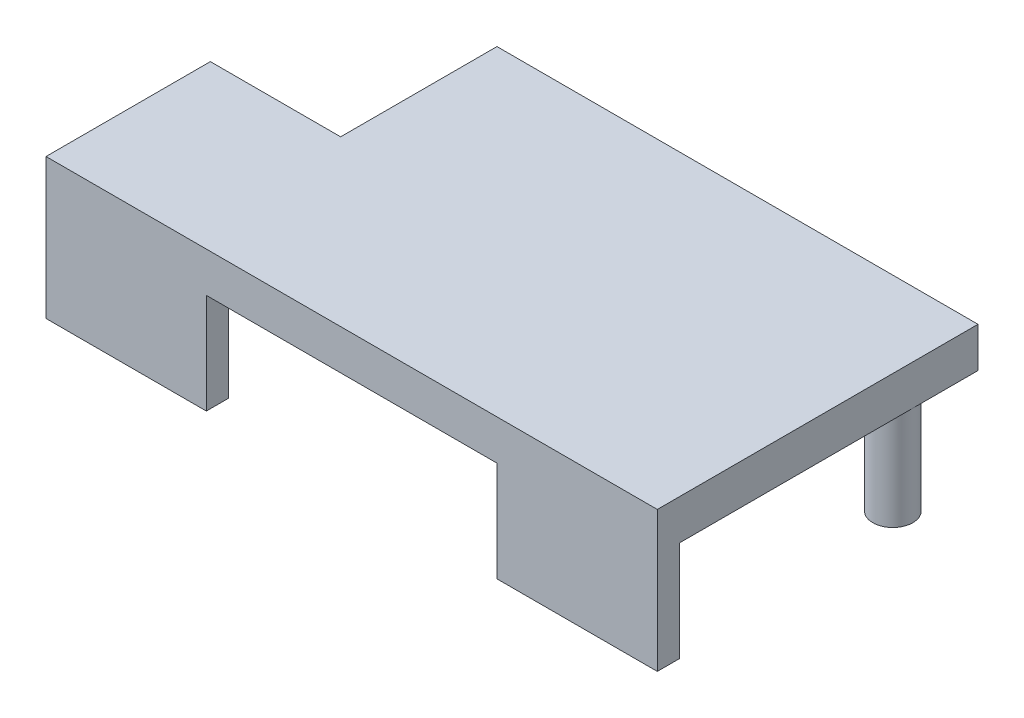
from build123d import *

# Parameters (mm, degrees)
SKETCH1_W           = 30.5
SKETCH1_H           = 16
BOSS_EXTRUDE1_DEPTH = 2
SKETCH3_R           = 1
SKETCH3_W           = 2.9
SKETCH3_H           = 2.8
SKETCH3_W_2         = 8
SKETCH3_H_2         = 1.1
BOSS_EXTRUDE3_DEPTH = 8
CUT_EXTRUDE2_DEPTH  = 10
CUT_EXTRUDE3_START  = -3
SKETCH5_R           = 1
SKETCH5_W           = 30.5
SKETCH5_H           = 1.1
CUT_EXTRUDE3_DEPTH  = 3


with BuildPart() as part:
    # Sketch1 → Boss-Extrude1 (new body)
    with BuildSketch(Plane(origin=(0, 0, 0), x_dir=(1, 0, 0), z_dir=(0, 1, 0))):
        Rectangle(SKETCH1_W, SKETCH1_H)
    extrude(amount=BOSS_EXTRUDE1_DEPTH)

    # Sketch3 → Boss-Extrude3 (add)
    with BuildSketch(Plane(origin=(0, 0, 0), x_dir=(1, 0, 0), z_dir=(0, 1, 0))):
        with Locations(Location((14.2, 4.8, 0), (0, 0, 270))):
            Circle(SKETCH3_R)
        with Locations((-4.25, 6.6)):
            Rectangle(SKETCH3_W, SKETCH3_H)
        with Locations((-11.25, -7.45)):
            Rectangle(SKETCH3_W_2, SKETCH3_H_2)
        with Locations((11.25, -7.45)):
            Rectangle(SKETCH3_W_2, SKETCH3_H_2)
    extrude(amount=-BOSS_EXTRUDE3_DEPTH)

    # Sketch4 → Cut-Extrude2 (cut)
    with BuildSketch(Plane(origin=(0, 0, 0), x_dir=(1, 0, 0), z_dir=(0, 1, 0))):
        Polygon((-15.25, 2.7), (-15.25, 8), (-8.75, 8), (-8.75, 2.7), (-8.75, 0.2), (-15.25, 0.2), align=None)
    extrude(amount=CUT_EXTRUDE2_DEPTH, mode=Mode.SUBTRACT)

    # Sketch5 → Cut-Extrude3 (cut)
    with BuildSketch(Plane.XZ.offset(8).offset(CUT_EXTRUDE3_START)):
        with Locations(Location((14.2, -4.8, 0), (0, 0, 90))):
            Circle(SKETCH5_R)
        with Locations((0, 7.45)):
            Rectangle(SKETCH5_W, SKETCH5_H)
    extrude(amount=CUT_EXTRUDE3_DEPTH, mode=Mode.SUBTRACT)


solid = part.part
